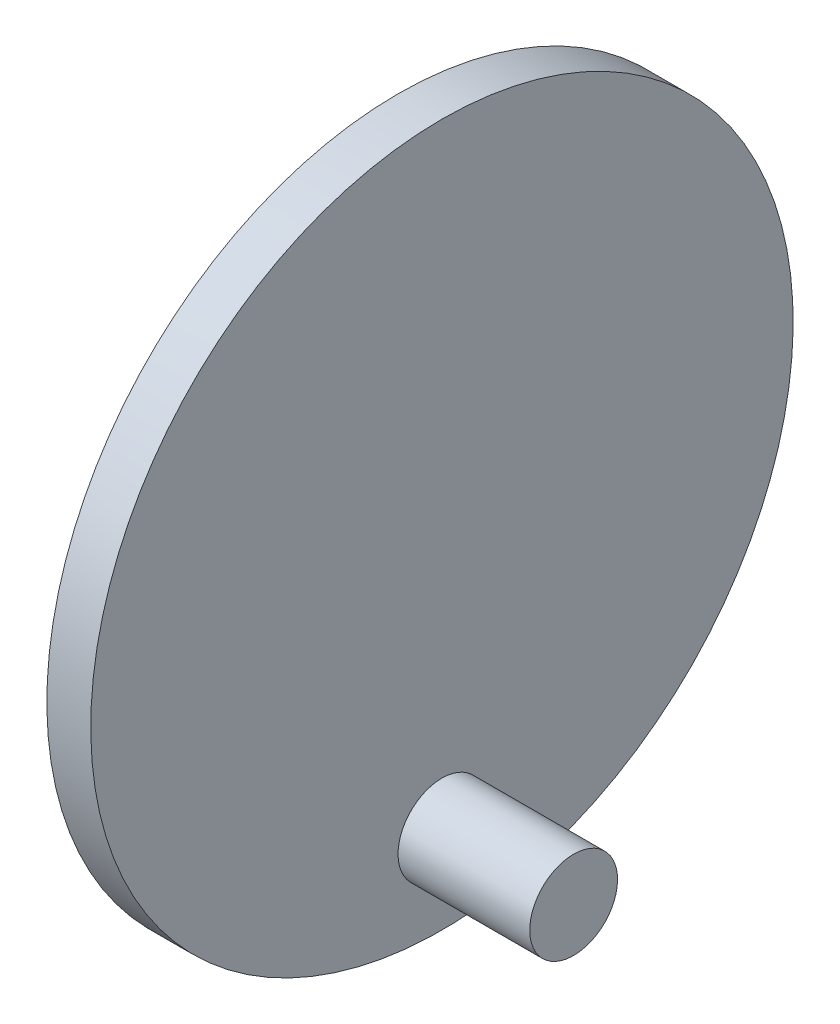
from build123d import *

# Parameters (mm, degrees)
BOSS_EXTRUDE1_DEPTH      = 5
BOSS_EXTRUDE1_DEPTH_BACK = 15
SKETCH2_R                = 7.5
SKETCH3_R                = 40
BOSS_EXTRUDE2_DEPTH      = 5
SKETCH4_R                = 5
BOSS_EXTRUDE3_DEPTH      = 15


with BuildPart() as part:
    # Sketch2 → Boss-Extrude1 (new, two sides: drawn at the far end of the back side and taken through both)
    with BuildSketch(Plane(origin=(10, 0, 0), x_dir=(0, 0, -1), z_dir=(1, 0, 0)).offset(-BOSS_EXTRUDE1_DEPTH_BACK)):
        with Locations(Location((0, 60, 0), (0, 0, 90))):
            Circle(SKETCH2_R)
    extrude(amount=BOSS_EXTRUDE1_DEPTH + BOSS_EXTRUDE1_DEPTH_BACK)

    # Sketch3 → Boss-Extrude2 (add)
    with BuildSketch(Plane(origin=(15, 0, 0), x_dir=(0, 0, -1), z_dir=(1, 0, 0))):
        with Locations(Location((0, 60, 0), (0, 0, 90))):
            Circle(SKETCH3_R)
    extrude(amount=BOSS_EXTRUDE2_DEPTH)

    # Sketch4 → Boss-Extrude3 (add)
    with BuildSketch(Plane(origin=(20, 0, 0), x_dir=(0, 0, -1), z_dir=(1, 0, 0))):
        with Locations(Location((0, 30, 0), (0, 0, 90))):
            Circle(SKETCH4_R)
    extrude(amount=BOSS_EXTRUDE3_DEPTH)


solid = part.part
